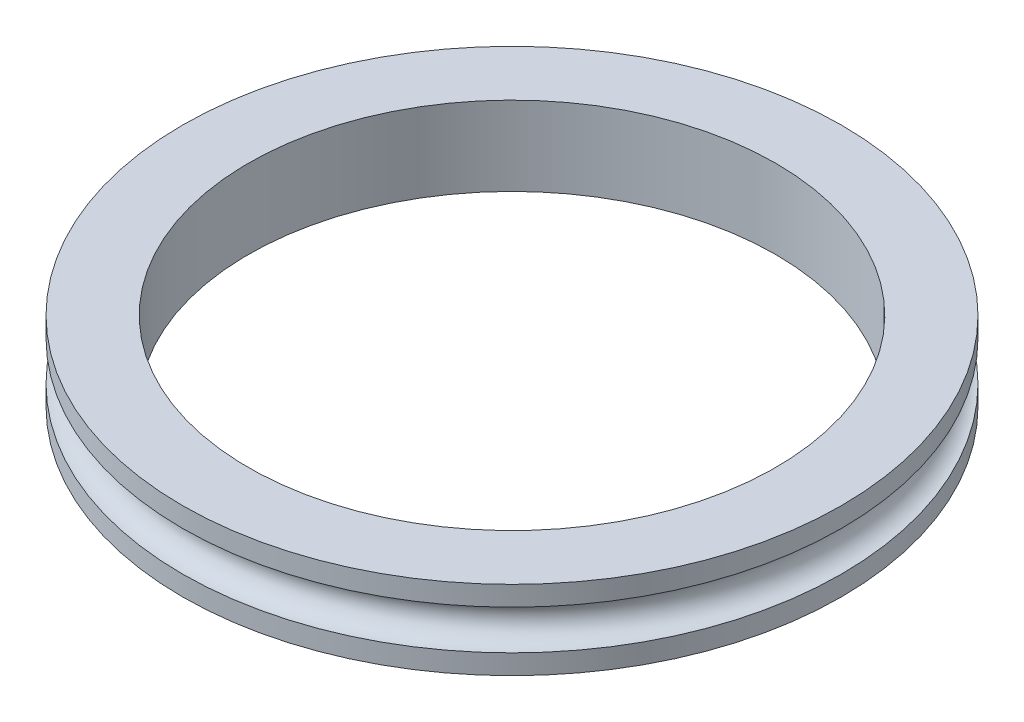
from build123d import *

# Parameters (mm, degrees)
CROQUIS1_R              = 12.5
SALIENTE_EXTRUIR1_DEPTH = 1.5
CROQUIS2_R              = 0.75
CROQUIS4_R              = 10
CORTAR_EXTRUIR1_DEPTH   = 18.930421077


with BuildPart() as part:
    # Croquis1 → Saliente-Extruir1 (new, symmetric)
    with BuildSketch(Plane(origin=(0, 0, 0), x_dir=(1, 0, 0), z_dir=(0, 1, 0))):
        with Locations(Location((0, 0, 0), (0, 0, 270))):
            Circle(CROQUIS1_R)
    extrude(amount=SALIENTE_EXTRUIR1_DEPTH, both=True)

    # Croquis2 → Cortar-Revolución1 (revolve, cut)
    with BuildSketch(Plane(origin=(0, 0, 0), x_dir=(0, 0, -1), z_dir=(1, 0, 0)), mode=Mode.PRIVATE) as cortar_revoluci_n1_sk:
        with Locations((12.5, 0)):
            Circle(CROQUIS2_R)
    revolve(cortar_revoluci_n1_sk.sketch.rotate(Axis((0, 1.5, 0), (0, -1, 0)), 180), axis=Axis((0, 1.5, 0), (0, -1, 0)), mode=Mode.SUBTRACT)

    # Croquis4 → Cortar-Extruir1 (cut, through all)
    with BuildSketch(Plane.XZ.offset(1.5)):
        with Locations(Location((0, 0, 0), (0, 0, 270))):
            Circle(CROQUIS4_R)
    extrude(amount=-CORTAR_EXTRUIR1_DEPTH, mode=Mode.SUBTRACT)


solid = part.part
